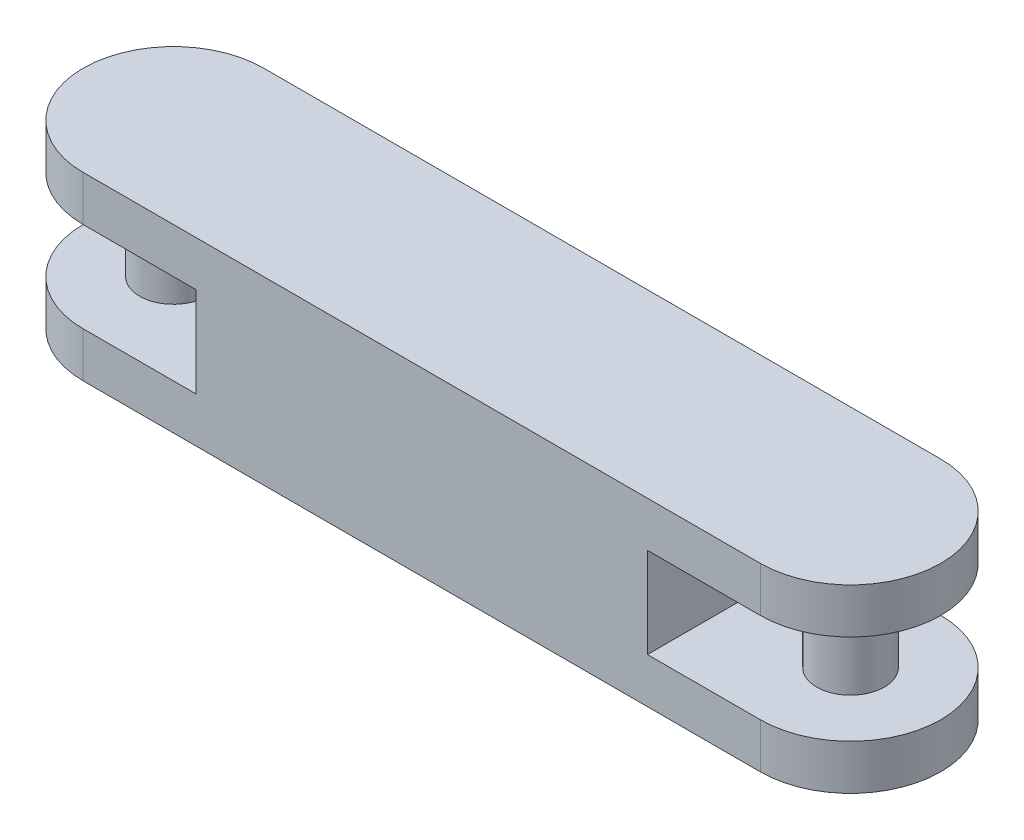
from build123d import *

# Parameters (mm, degrees)
BOSS_EXTRUDE1_DEPTH     = 40
SKETCH3_W               = 90
SKETCH3_H               = 40
CUT_EXTRUDE_THIN1_DEPTH = 80
SKETCH4_R               = 15
BOSS_EXTRUDE2_DEPTH     = 80


with BuildPart() as part:
    # Sketch2 → Boss-Extrude1 (new, symmetric)
    with BuildSketch(Plane(origin=(0, 0, 0), x_dir=(1, 0, 0), z_dir=(0, 1, 0))):
        with BuildLine():
            Line((0, 40), (300, 40))
            ThreePointArc((300, 40), (340, 0), (300, -40))
            Line((300, -40), (0, -40))
            ThreePointArc((0, -40), (-40, 0), (0, 40))
        make_face()
    extrude(amount=BOSS_EXTRUDE1_DEPTH, both=True)

    # Sketch3 → Cut-Extrude-Thin1 (cut)
    with BuildSketch(Plane.XY.offset(40)):
        with Locations((5, 0)):
            Rectangle(SKETCH3_W, SKETCH3_H)
        with Locations((295, 0)):
            Rectangle(SKETCH3_W, SKETCH3_H)
    extrude(amount=-CUT_EXTRUDE_THIN1_DEPTH, mode=Mode.SUBTRACT)

    # Sketch4 → Boss-Extrude2 (add)
    with BuildSketch(Plane.XZ.offset(40)):
        Circle(SKETCH4_R)
        with Locations(Location((300, 0, 0), (0, 0, 180))):
            Circle(SKETCH4_R)
    extrude(amount=-BOSS_EXTRUDE2_DEPTH)


solid = part.part
